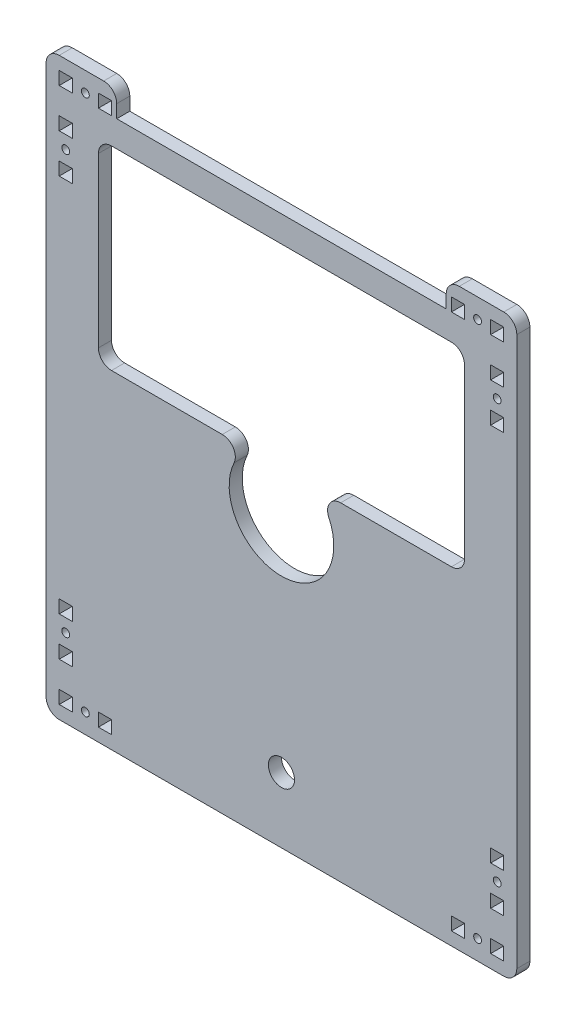
from build123d import *

# Parameters (mm, degrees)
SKETCH1_R           = 5
SKETCH1_R_2         = 1.5
SKETCH1_W           = 5
SKETCH1_H           = 5
BOSS_EXTRUDE1_DEPTH = 5
FILLET1_R           = 5


with BuildPart() as part:
    # Sketch1 → Boss-Extrude1 (new body)
    with BuildSketch(Plane.XY):
        Polygon((-90, 110), (-90, -110), (90, -110), (90, 110), (63, 110), (63, 100), (-63, 100), (-63, 110), align=None)
        with Locations((0, -85)):
            Circle(SKETCH1_R, mode=Mode.SUBTRACT)
        with Locations((-75, 102.5)):
            Circle(SKETCH1_R_2, mode=Mode.SUBTRACT)
        with Locations(Location((-75, -102.5, 0), (0, 0, 90))):
            Circle(SKETCH1_R_2, mode=Mode.SUBTRACT)
        with Locations((75, -102.5)):
            Circle(SKETCH1_R_2, mode=Mode.SUBTRACT)
        with Locations(Location((75, 102.5, 0), (0, 0, 180))):
            Circle(SKETCH1_R_2, mode=Mode.SUBTRACT)
        with Locations(Location((82.5, 80, 0), (0, 0, 90))):
            Circle(SKETCH1_R_2, mode=Mode.SUBTRACT)
        with Locations((82.5, -80)):
            Circle(SKETCH1_R_2, mode=Mode.SUBTRACT)
        with Locations(Location((-82.5, 80, 0), (0, 0, 270))):
            Circle(SKETCH1_R_2, mode=Mode.SUBTRACT)
        with Locations(Location((-82.5, -80, 0), (0, 0, 180))):
            Circle(SKETCH1_R_2, mode=Mode.SUBTRACT)
        with BuildLine():
            Line((-70, 90), (70, 90))
            Line((70, 90), (70, 15.612494996))
            Line((70, 15.612494996), (12.5, 15.612494996))
            ThreePointArc((12.5, 15.612494996), (0, -20), (-12.5, 15.612494996))
            Line((-12.5, 15.612494996), (-70, 15.612494996))
            Line((-70, 15.612494996), (-70, 90))
        make_face(mode=Mode.SUBTRACT)
        with Locations((-82.5, 102.5)):
            Rectangle(SKETCH1_W, SKETCH1_H, mode=Mode.SUBTRACT)
        with Locations((-67.5, 102.5)):
            Rectangle(SKETCH1_W, SKETCH1_H, mode=Mode.SUBTRACT)
        with Locations((-82.5, -102.5)):
            Rectangle(SKETCH1_W, SKETCH1_H, mode=Mode.SUBTRACT)
        with Locations((-67.5, -102.5)):
            Rectangle(SKETCH1_W, SKETCH1_H, mode=Mode.SUBTRACT)
        with Locations((82.5, -102.5)):
            Rectangle(SKETCH1_W, SKETCH1_H, mode=Mode.SUBTRACT)
        with Locations((67.5, -102.5)):
            Rectangle(SKETCH1_W, SKETCH1_H, mode=Mode.SUBTRACT)
        with Locations((82.5, 102.5)):
            Rectangle(SKETCH1_W, SKETCH1_H, mode=Mode.SUBTRACT)
        with Locations((67.5, 102.5)):
            Rectangle(SKETCH1_W, SKETCH1_H, mode=Mode.SUBTRACT)
        with Locations((82.5, 87.5)):
            Rectangle(SKETCH1_W, SKETCH1_H, mode=Mode.SUBTRACT)
        with Locations((82.5, 72.5)):
            Rectangle(SKETCH1_W, SKETCH1_H, mode=Mode.SUBTRACT)
        with Locations((82.5, -87.5)):
            Rectangle(SKETCH1_W, SKETCH1_H, mode=Mode.SUBTRACT)
        with Locations((82.5, -72.5)):
            Rectangle(SKETCH1_W, SKETCH1_H, mode=Mode.SUBTRACT)
        with Locations((-82.5, 87.5)):
            Rectangle(SKETCH1_W, SKETCH1_H, mode=Mode.SUBTRACT)
        with Locations((-82.5, 72.5)):
            Rectangle(SKETCH1_W, SKETCH1_H, mode=Mode.SUBTRACT)
        with Locations((-82.5, -87.5)):
            Rectangle(SKETCH1_W, SKETCH1_H, mode=Mode.SUBTRACT)
        with Locations((-82.5, -72.5)):
            Rectangle(SKETCH1_W, SKETCH1_H, mode=Mode.SUBTRACT)
    extrude(amount=BOSS_EXTRUDE1_DEPTH)

    # Fillet1
    fillet1_edges = [part.edges().sort_by_distance(p)[0] for p in [
        (-63, 110, 2.5),
        (63, 110, 2.5),
        (90, 110, 2.5),
        (90, -110, 2.5),
        (-90, -110, 2.5),
        (-90, 110, 2.5),
        (-12.5, 15.612494996, 2.5),
        (12.5, 15.612494996, 2.5),
        (70, 15.612494996, 2.5),
        (70, 90, 2.5),
        (-70, 90, 2.5),
        (-70, 15.612494996, 2.5),
    ]]
    fillet(fillet1_edges, radius=FILLET1_R)


solid = part.part
